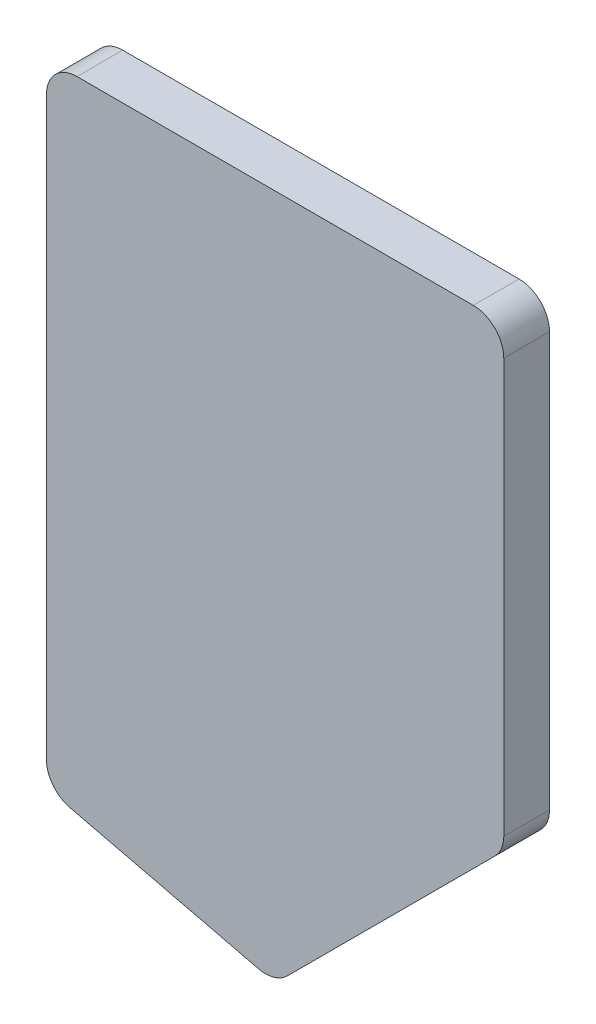
from build123d import *

# Parameters (mm, degrees)
BOSS_EXTRUDE1_DEPTH = 15
FILLET1_R           = 10
FILLET2_R           = 10
FILLET4_R           = 10
FILLET5_R           = 10
FILLET6_R           = 10
CUT_EXTRUDE1_DEPTH  = 2


with BuildPart() as part:
    # Sketch1 → Boss-Extrude1 (new body)
    with BuildSketch(Plane.XY):
        Polygon((0, 103.5), (0, -103.5), (75, -121.5), (150, -46.5), (150, 103.5), align=None)
    extrude(amount=BOSS_EXTRUDE1_DEPTH)

    # Fillet1
    fillet1_edges = [part.edges().sort_by_distance(p)[0] for p in [
        (0, -103.5, 7.5),
    ]]
    fillet(fillet1_edges, radius=FILLET1_R)

    # Fillet2
    fillet2_edges = [part.edges().sort_by_distance(p)[0] for p in [
        (75, -121.5, 7.5),
    ]]
    fillet(fillet2_edges, radius=FILLET2_R)

    # Fillet4
    fillet4_edges = [part.edges().sort_by_distance(p)[0] for p in [
        (150, -46.5, 7.5),
    ]]
    fillet(fillet4_edges, radius=FILLET4_R)

    # Fillet5
    fillet5_edges = [part.edges().sort_by_distance(p)[0] for p in [
        (150, 103.5, 7.5),
    ]]
    fillet(fillet5_edges, radius=FILLET5_R)

    # Fillet6
    fillet6_edges = [part.edges().sort_by_distance(p)[0] for p in [
        (0, 103.5, 7.5),
    ]]
    fillet(fillet6_edges, radius=FILLET6_R)

    # Sketch2 → Cut-Extrude1 (cut)
    with BuildSketch(Plane(origin=(0, 0, 0), x_dir=(-1, 0, 0), z_dir=(0, 0, -1))):
        Polygon((-12.235489358, 0), (-12.235489358, 3.562429258), (-83.581556078, 94.421338251), (-87.783155362, 94.421338251), (-87.783155362, 3.562429258), (-87.783155362, 0), (-83.581556078, 0), (-46.597715557, 0), (-42.603563367, 0), align=None)
        Polygon((-46.597715557, 3.562429258), (-83.581556078, 3.562429258), (-83.581556078, 89.170075728), (-46.597715557, 42.94675871), align=None, mode=Mode.SUBTRACT)
        Polygon((-42.603563367, 37.954768687), (-15.085832519, 3.562429258), (-42.603563367, 3.562429258), align=None, mode=Mode.SUBTRACT)
    extrude(amount=-CUT_EXTRUDE1_DEPTH, mode=Mode.SUBTRACT)


solid = part.part
